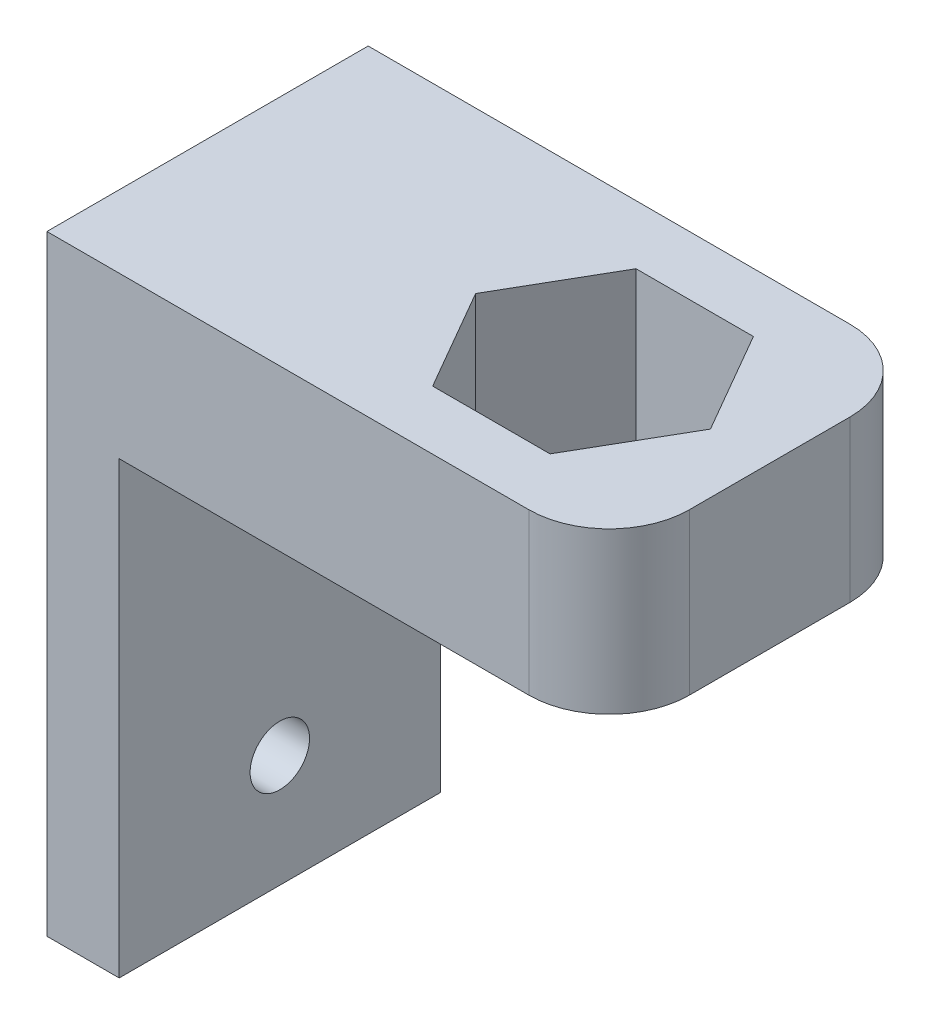
from build123d import *

# Parameters (mm, degrees)
SKETCH1_W           = 35
SKETCH1_H           = 20
BOSS_EXTRUDE1_DEPTH = 10
FILLET1_R           = 5
CUT_EXTRUDE2_DEPTH  = 23.5
SKETCH5_W           = 4.5
SKETCH5_H           = 20
BOSS_EXTRUDE3_DEPTH = 28
SKETCH6_R           = 1.85
CUT_EXTRUDE3_DEPTH  = 43.594013664


with BuildPart() as part:
    # Sketch1 → Boss-Extrude1 (new body)
    with BuildSketch(Plane(origin=(0, 0, 0), x_dir=(1, 0, 0), z_dir=(0, 1, 0))):
        Rectangle(SKETCH1_W, SKETCH1_H)
    extrude(amount=BOSS_EXTRUDE1_DEPTH)

    # Fillet1
    fillet1_edges = [part.edges().sort_by_distance(p)[0] for p in [
        (17.5, 5, 10),
        (17.5, 5, -10),
    ]]
    fillet(fillet1_edges, radius=FILLET1_R)

    # Sketch4 → Cut-Extrude2 (cut, through all)
    with BuildSketch(Plane(origin=(0, 10, 0), x_dir=(1, 0, 0), z_dir=(0, 1, 0))):
        Polygon((10.154627204, -6.33), (13.809254408, 0), (10.154627204, 6.33), (2.845372796, 6.33), (-0.809254408, 0), (2.845372796, -6.33), align=None)
    extrude(amount=-CUT_EXTRUDE2_DEPTH, mode=Mode.SUBTRACT)

    # Sketch5 → Boss-Extrude3 (add)
    with BuildSketch(Plane.XZ):
        with Locations((-15.25, 0)):
            Rectangle(SKETCH5_W, SKETCH5_H)
    extrude(amount=BOSS_EXTRUDE3_DEPTH)

    # Sketch6 → Cut-Extrude3 (cut, through all)
    with BuildSketch(Plane(origin=(-13, 0, 0), x_dir=(0, 0, -1), z_dir=(1, 0, 0))):
        with Locations((0, -6)):
            Circle(SKETCH6_R)
        with Locations((0, -21)):
            Circle(SKETCH6_R)
    extrude(amount=-CUT_EXTRUDE3_DEPTH, mode=Mode.SUBTRACT)


solid = part.part
